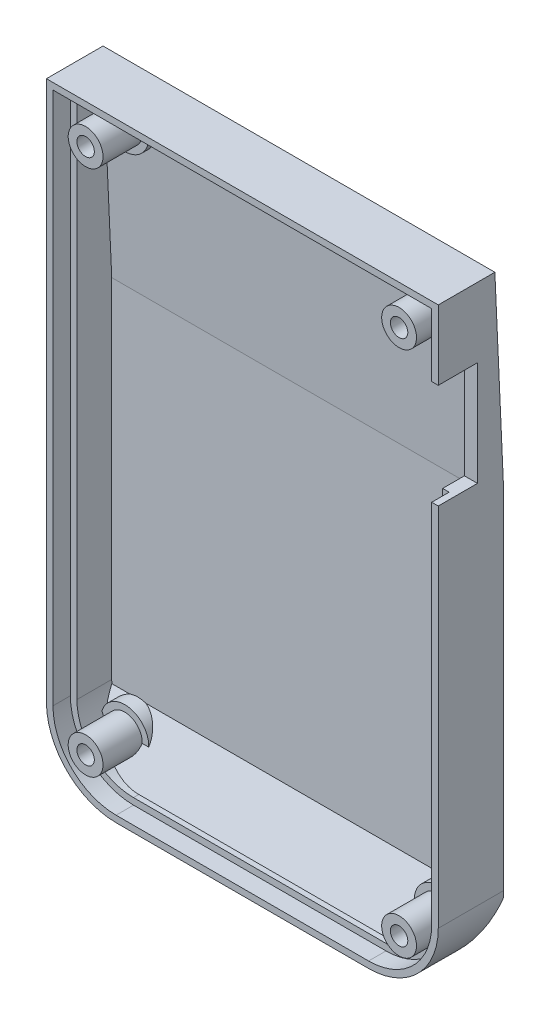
from build123d import *

# Parameters (mm, degrees)
EXTRUDE_1_DEPTH     = 7.5
CUT_EXTRUDE_1_DEPTH = 84.553874835
SHELL_1_T           = -1.5
CUT_EXTRUDE_START   = -2
CUT_EXTRUDE_2_DEPTH = 2
SKETCH_4_R          = 2.75
EXTRUDE_2_DEPTH     = 1.5
SKETCH_5_R          = 2
EXTRUDE_3_DEPTH     = 4.5
SKETCH_6_R          = 1.75
CUT_EXTRUDE_3_DEPTH = 2
SKETCH_9_R          = 1
CUT_EXTRUDE_4_DEPTH = 84.553874835
CUT_EXTRUDE_5_DEPTH = 84.553874835
SKETCH_12_W         = 1.5
SKETCH_12_H         = 12
CUT_EXTRUDE_6_DEPTH = 4.5


with BuildPart() as part:
    # 草图1 → 凸台-拉伸1 (new body)
    with BuildSketch(Plane.XY):
        with BuildLine():
            Line((-45, 70), (0, 70))
            Line((0, 70), (0, 8))
            ThreePointArc((0, 8), (-2.343145751, 2.343145751), (-8, 0))
            Line((-8, 0), (-37, 0))
            ThreePointArc((-37, 0), (-42.656854249, 2.343145751), (-45, 8))
            Line((-45, 8), (-45, 70))
        make_face()
    extrude(amount=EXTRUDE_1_DEPTH)

    # 草图2 → 切除-拉伸1 (cut, through all)
    with BuildSketch(Plane(origin=(0, 0, 0), x_dir=(0, 0, -1), z_dir=(1, 0, 0))):
        Polygon((0, 0), (0, 7.2), (-4, 0), align=None)
        Polygon((0, 70), (-1, 70), (0, 48), align=None)
    extrude(amount=-CUT_EXTRUDE_1_DEPTH, mode=Mode.SUBTRACT)

    # 抽壳1
    shell_1_openings = [part.faces().sort_by_distance(p)[0] for p in [
        (-22.5, 35.292176643, 7.5),
    ]]
    offset(amount=SHELL_1_T, openings=shell_1_openings, kind=Kind.INTERSECTION)

    # 草图3 → 切除-拉伸2 (cut)
    with BuildSketch(Plane.XY.offset(7.5).offset(CUT_EXTRUDE_START)):
        with BuildLine():
            Line((-44.25, 69.25), (-0.75, 69.25))
            Line((-0.75, 69.25), (-0.75, 8))
            ThreePointArc((-0.75, 8), (-2.873475836, 2.873475836), (-8, 0.75))
            Line((-8, 0.75), (-37, 0.75))
            ThreePointArc((-37, 0.75), (-42.126524164, 2.873475836), (-44.25, 8))
            Line((-44.25, 8), (-44.25, 69.25))
        make_face()
        with BuildLine():
            Line((-43.5, 68.5), (-1.5, 68.5))
            Line((-1.5, 68.5), (-1.5, 8))
            ThreePointArc((-1.5, 8), (-3.403805922, 3.403805922), (-8, 1.5))
            Line((-8, 1.5), (-37, 1.5))
            ThreePointArc((-37, 1.5), (-41.596194078, 3.403805922), (-43.5, 8))
            Line((-43.5, 8), (-43.5, 68.5))
        make_face(mode=Mode.SUBTRACT)
    extrude(amount=CUT_EXTRUDE_2_DEPTH, mode=Mode.SUBTRACT)

    # 草图4 → 凸台-拉伸2 (add)
    with BuildSketch(Plane.XY.offset(1.5)):
        with Locations(Location((-40.5, 65.5, 0), (0, 0, 270))):
            Circle(SKETCH_4_R)
        with Locations((-40.5, 5)):
            Circle(SKETCH_4_R)
        with Locations((-4.5, 5)):
            Circle(SKETCH_4_R)
        with Locations(Location((-4.5, 65.5, 0), (0, 0, 180))):
            Circle(SKETCH_4_R)
    extrude(amount=EXTRUDE_2_DEPTH)

    # 草图5 → 凸台-拉伸3 (add)
    with BuildSketch(Plane.XY.offset(3)):
        with Locations((-40.5, 65.5)):
            Circle(SKETCH_5_R)
        with Locations((-4.5, 65.5)):
            Circle(SKETCH_5_R)
        with Locations(Location((-40.5, 5, 0), (0, 0, 183.190472592))):
            Circle(SKETCH_5_R)
        with Locations(Location((-4.5, 5, 0), (0, 0, 183.190472592))):
            Circle(SKETCH_5_R)
    extrude(amount=EXTRUDE_3_DEPTH)

    # 草图6 → 切除-拉伸3 (cut)
    with BuildSketch(Plane(origin=(0, 0, 0), x_dir=(-1, 0, 0), z_dir=(0, 0, -1))):
        with Locations((4.5, 65.5)):
            Circle(SKETCH_6_R)
        with Locations((40.5, 65.5)):
            Circle(SKETCH_6_R)
        with Locations((40.5, 5)):
            Circle(SKETCH_6_R)
        with Locations((4.5, 5)):
            Circle(SKETCH_6_R)
    extrude(amount=-CUT_EXTRUDE_3_DEPTH, mode=Mode.SUBTRACT)

    # 草图9 → 切除-拉伸4 (cut, through all)
    with BuildSketch(Plane.XY):
        with Locations(Location((-40.5, 65.5, 0), (0, 0, 180))):
            Circle(SKETCH_9_R)
        with Locations(Location((-4.5, 65.5, 0), (0, 0, 180))):
            Circle(SKETCH_9_R)
        with Locations(Location((-4.5, 5, 0), (0, 0, 180))):
            Circle(SKETCH_9_R)
        with Locations(Location((-40.5, 5, 0), (0, 0, 180))):
            Circle(SKETCH_9_R)
    extrude(amount=CUT_EXTRUDE_4_DEPTH, mode=Mode.SUBTRACT)

    # 草图11 → 切除-拉伸5 (cut, through all)
    with BuildSketch(Plane(origin=(0, 0, 0), x_dir=(0, 0, -1), z_dir=(1, 0, 0))):
        Polygon((0, 0), (0, 7.2), (-4, 0), align=None)
        Polygon((0, 70), (-1, 70), (0, 48), align=None)
    extrude(amount=-CUT_EXTRUDE_5_DEPTH, mode=Mode.SUBTRACT)

    # 草图12 → 切除-拉伸6 (cut)
    with BuildSketch(Plane.XY.offset(7.5)):
        with Locations((-0.75, 56)):
            Rectangle(SKETCH_12_W, SKETCH_12_H)
    extrude(amount=-CUT_EXTRUDE_6_DEPTH, mode=Mode.SUBTRACT)


solid = part.part
